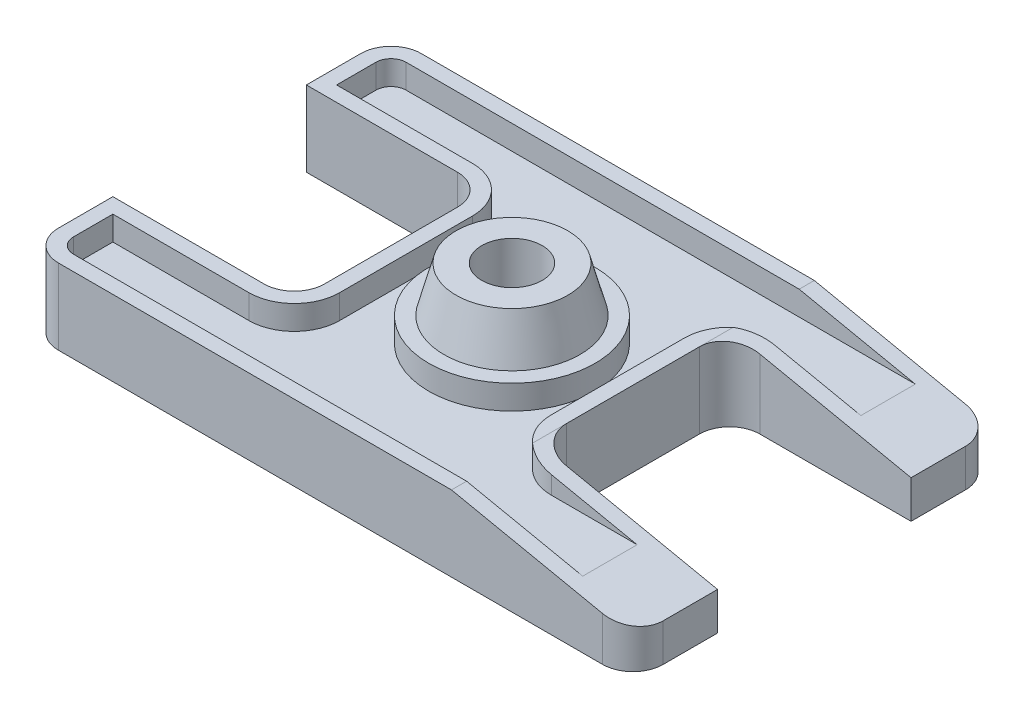
from build123d import *

# Parameters (mm, degrees)
BOSS_EXTRUDE1_DEPTH     = 25
BOSS_EXTRUDE2_START     = 25
SKETCH1_3_R             = 22.5
BOSS_EXTRUDE2_DEPTH     = 15
BOSS_EXTRUDE2_TAPER     = 15
SKETCH4_R               = 27.5
CUT_EXTRUDE3_DEPTH      = 8
SKETCH1_4_R             = 10
CUT_EXTRUDE1_DEPTH      = 124.288280092
CUT_EXTRUDE2_DEPTH      = 124.288280092
CUT_EXTRUDE2_DEPTH_BACK = 124.288280092


with BuildPart() as part:
    # Sketch1 → Boss-Extrude1 (new body)
    with BuildSketch(Plane(origin=(0, 0, 0), x_dir=(1, 0, 0), z_dir=(0, 1, 0))):
        with BuildLine():
            Line((-90, -60), (90, -60))
            ThreePointArc((90, -60), (97.071067812, -57.071067812), (100, -50))
            Line((100, -50), (100, -32))
            Line((100, -32), (50, -32))
            ThreePointArc((50, -32), (42.928932188, -29.071067812), (40, -22))
            Line((40, -22), (40, 22))
            ThreePointArc((40, 22), (42.928932188, 29.071067812), (50, 32))
            Line((50, 32), (100, 32))
            Line((100, 32), (100, 50))
            ThreePointArc((100, 50), (97.071067812, 57.071067812), (90, 60))
            Line((90, 60), (-90, 60))
            ThreePointArc((-90, 60), (-97.071067812, 57.071067812), (-100, 50))
            Line((-100, 50), (-100, 32))
            Line((-100, 32), (-50, 32))
            ThreePointArc((-50, 32), (-42.928932188, 29.071067812), (-40, 22))
            Line((-40, 22), (-40, -22))
            ThreePointArc((-40, -22), (-42.928932188, -29.071067812), (-50, -32))
            Line((-50, -32), (-100, -32))
            Line((-100, -32), (-100, -50))
            ThreePointArc((-100, -50), (-97.071067812, -57.071067812), (-90, -60))
        make_face()
    extrude(amount=BOSS_EXTRUDE1_DEPTH)

    # Sketch1<3> → Boss-Extrude2 (add)
    with BuildSketch(Plane(origin=(0, 0, 0), x_dir=(1, 0, 0), z_dir=(0, 1, 0)).offset(BOSS_EXTRUDE2_START)):
        Circle(SKETCH1_3_R)
    extrude(amount=BOSS_EXTRUDE2_DEPTH, taper=BOSS_EXTRUDE2_TAPER)

    # Sketch4 → Cut-Extrude3 (cut)
    with BuildSketch(Plane(origin=(0, 25, 0), x_dir=(1, 0, 0), z_dir=(0, 1, 0))):
        with BuildLine():
            Line((-95, 50), (-95, 37))
            Line((-95, 37), (-50, 37))
            ThreePointArc((-50, 37), (-39.393398282, 32.606601718), (-35, 22))
            Line((-35, 22), (-35, -22))
            ThreePointArc((-35, -22), (-39.393398282, -32.606601718), (-50, -37))
            Line((-50, -37), (-95, -37))
            Line((-95, -37), (-95, -50))
            ThreePointArc((-95, -50), (-93.535533906, -53.535533906), (-90, -55))
            Line((-90, -55), (90, -55))
            ThreePointArc((90, -55), (93.535533906, -53.535533906), (95, -50))
            Line((95, -50), (95, -37))
            Line((95, -37), (50, -37))
            ThreePointArc((50, -37), (39.393398282, -32.606601718), (35, -22))
            Line((35, -22), (35, 22))
            ThreePointArc((35, 22), (39.393398282, 32.606601718), (50, 37))
            Line((50, 37), (95, 37))
            Line((95, 37), (95, 50))
            ThreePointArc((95, 50), (93.535533906, 53.535533906), (90, 55))
            Line((90, 55), (-90, 55))
            ThreePointArc((-90, 55), (-93.535533906, 53.535533906), (-95, 50))
        make_face()
        with Locations(Location((0, 0, 0), (0, 0, 270))):
            Circle(SKETCH4_R, mode=Mode.SUBTRACT)
    extrude(amount=-CUT_EXTRUDE3_DEPTH, mode=Mode.SUBTRACT)

    # Sketch1<4> → Cut-Extrude1 (cut, through all)
    with BuildSketch(Plane(origin=(0, 0, 0), x_dir=(1, 0, 0), z_dir=(0, 1, 0))):
        with Locations(Location((0, 0, 0), (0, 0, 270))):
            Circle(SKETCH1_4_R)
    extrude(amount=CUT_EXTRUDE1_DEPTH, mode=Mode.SUBTRACT)

    # Sketch3 → Cut-Extrude2 (cut, two sides: drawn at the far end of the back side and taken through both)
    with BuildSketch(Plane.XY.offset(-CUT_EXTRUDE2_DEPTH_BACK)):
        Polygon((40, 25), (100, 12.5), (100, 25), align=None)
    extrude(amount=CUT_EXTRUDE2_DEPTH + CUT_EXTRUDE2_DEPTH_BACK, mode=Mode.SUBTRACT)


solid = part.part
